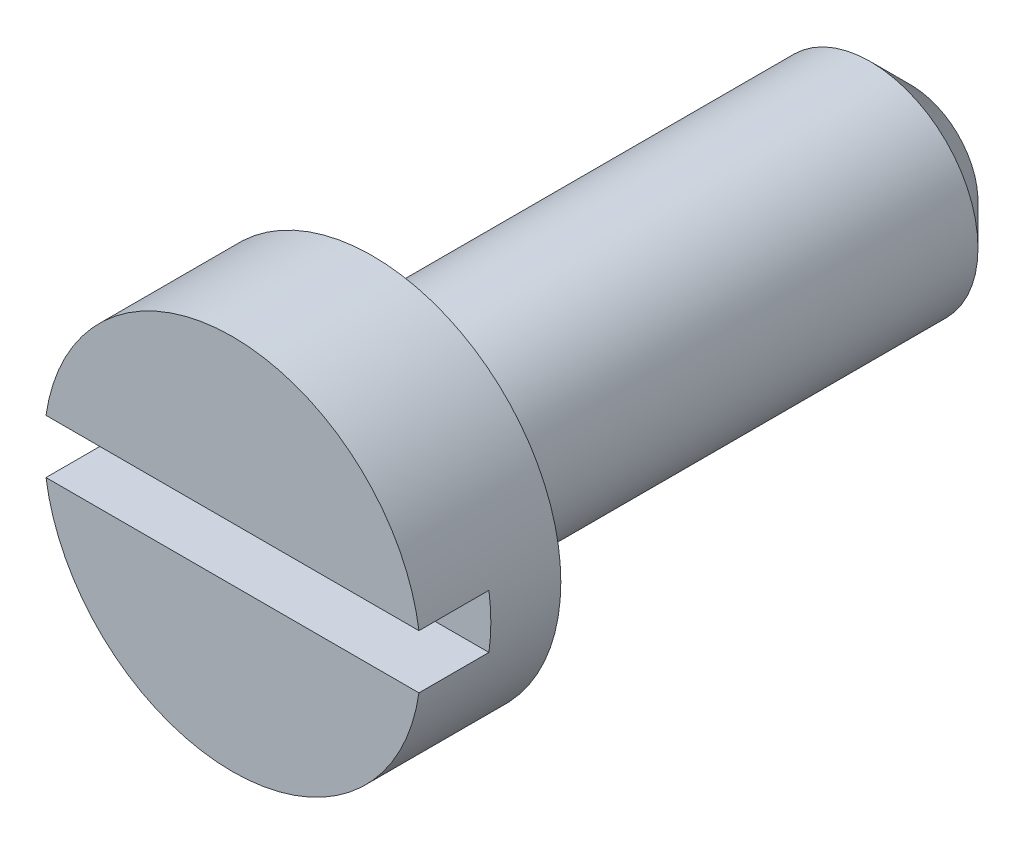
from build123d import *

# Parameters (mm, degrees)
SKETCH_12_R         = 3.5
EXTRUDE_3_DEPTH     = 2.6
SKETCH_13_R         = 2
EXTRUDE_4_DEPTH     = 10
SKETCH_20_W         = 8.088235294
SKETCH_20_H         = 1
CUT_EXTRUDE_8_DEPTH = 1.3
CHAMFER_1_SIZE      = 0.75


with BuildPart() as part:
    # Эскиз12 → Вытянуть3 (new body)
    with BuildSketch(Plane.XY):
        Circle(SKETCH_12_R)
    extrude(amount=EXTRUDE_3_DEPTH)

    # Эскиз13 → Вытянуть4 (add)
    with BuildSketch(Plane(origin=(0, 0, 0), x_dir=(-1, 0, 0), z_dir=(0, 0, -1))):
        with Locations(Location((0, 0, 0), (0, 0, 180))):
            Circle(SKETCH_13_R)
    extrude(amount=EXTRUDE_4_DEPTH)

    # Эскиз20 → Вырез-Вытянуть8 (cut)
    with BuildSketch(Plane.XY.offset(2.6)):
        with Locations((-0.053921569, 0)):
            Rectangle(SKETCH_20_W, SKETCH_20_H)
    extrude(amount=-CUT_EXTRUDE_8_DEPTH, mode=Mode.SUBTRACT)

    # Фаска1
    chamfer_1_edges = [part.edges().sort_by_distance(p)[0] for p in [
        (-2, 0, -10),
    ]]
    chamfer(chamfer_1_edges, length=CHAMFER_1_SIZE)


solid = part.part
